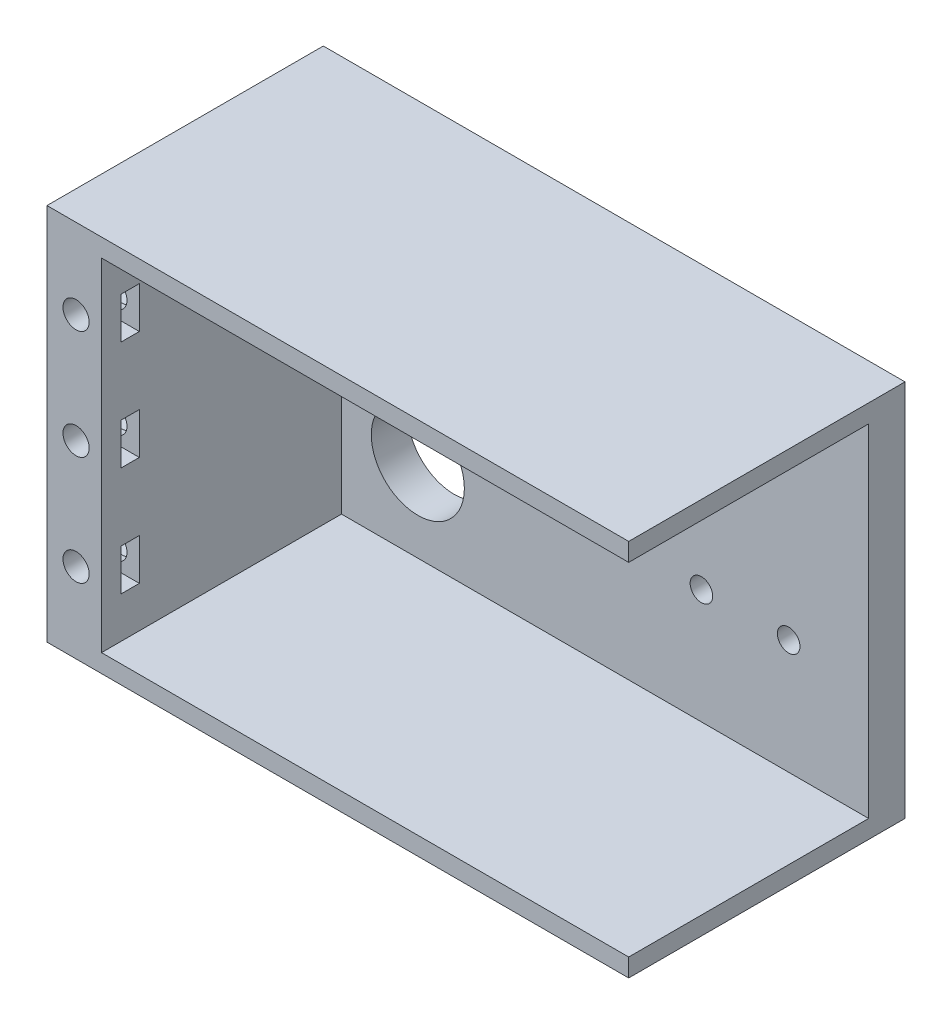
from build123d import *

# Parameters (mm, degrees)
ESQUISSE3_W                                        = 80
ESQUISSE3_H                                        = 52
BOSS_EXTRU_1_DEPTH                                 = 5
ESQUISSE4_R                                        = 6.4
ENL_V_MAT_EXTRU_1_DEPTH                            = 10
BOSS_EXTRU_2_DEPTH                                 = 33
CHAMBRAGE_POUR_VIS_T_TE_RONDE_BOMB_E_M_D           = 3.1
CHAMBRAGE_POUR_VIS_T_TE_RONDE_BOMB_E_M_CBORE_D     = 6
CHAMBRAGE_POUR_VIS_T_TE_RONDE_BOMB_E_M_CBORE_DEPTH = 2.1
R_P_TITION_LIN_AIRE1_COUNT                         = 2
R_P_TITION_LIN_AIRE1_PITCH                         = 12
R_P_TITION_LIN_AIRE1_COUNT_DIR2                    = 2
R_P_TITION_LIN_AIRE1_PITCH_DIR2                    = 24
ENL_V_MAT_EXTRU_2_REACH                            = 94.304
ESQUISSE11_W                                       = 2.5
ESQUISSE11_H                                       = 5.7
R_P_TITION_LIN_AIRE2_COUNT                         = 3
R_P_TITION_LIN_AIRE2_PITCH                         = 15
R_P_TITION_LIN_AIRE3_COUNT                         = 3
R_P_TITION_LIN_AIRE3_PITCH                         = 15


with BuildPart() as part:
    # Esquisse3 → Boss.-Extru.1 (new body)
    with BuildSketch(Plane.XY):
        Rectangle(ESQUISSE3_W, ESQUISSE3_H)
    extrude(amount=BOSS_EXTRU_1_DEPTH)

    # Esquisse4 → Enlèv. mat.-Extru.1 (cut)
    with BuildSketch(Plane.XY.offset(5)):
        with Locations((-22, -12)):
            Circle(ESQUISSE4_R)
    extrude(amount=-ENL_V_MAT_EXTRU_1_DEPTH, mode=Mode.SUBTRACT)

    # Esquisse5 → Boss.-Extru.2 (add)
    with BuildSketch(Plane.XY.offset(5)):
        Polygon((-40, -26), (40, -26), (40, -23.5), (-32.5, -23.5), (-32.5, 23.5), (40, 23.5), (40, 26), (-40, 26), align=None)
    extrude(amount=BOSS_EXTRU_2_DEPTH)

    # Chambrage pour vis à tête ronde bombée M2.51 (through all)
    with Locations(Plane(origin=(0, 0, 0), x_dir=(-1, 0, 0), z_dir=(0, 0, -1))):
        with Locations((-17, 16.25)):
            chambrage_pour_vis_t_te_ronde_bomb_e_m = CounterBoreHole(CHAMBRAGE_POUR_VIS_T_TE_RONDE_BOMB_E_M_D / 2, CHAMBRAGE_POUR_VIS_T_TE_RONDE_BOMB_E_M_CBORE_D / 2, CHAMBRAGE_POUR_VIS_T_TE_RONDE_BOMB_E_M_CBORE_DEPTH)

    # Répétition linéaire1: Chambrage pour vis _ t_te ronde bomb_e M 2 × 2
    with Locations(*[(i * R_P_TITION_LIN_AIRE1_PITCH, -j * R_P_TITION_LIN_AIRE1_PITCH_DIR2, 0) for i in range(R_P_TITION_LIN_AIRE1_COUNT) for j in range(R_P_TITION_LIN_AIRE1_COUNT_DIR2) if (i, j) != (0, 0)]):
        add(chambrage_pour_vis_t_te_ronde_bomb_e_m, mode=Mode.SUBTRACT)

    # Esquisse11 → Enlèv. mat.-Extru.2 (cut, up to next)
    with BuildSketch(Plane.ZY.offset(40), mode=Mode.PRIVATE) as enl_v_mat_extru_2_sk1:
        with Locations((34.05, 15)):
            Rectangle(ESQUISSE11_W, ESQUISSE11_H)
    enl_v_mat_extru_2_tool1 = extrude(enl_v_mat_extru_2_sk1.sketch, amount=-ENL_V_MAT_EXTRU_2_REACH, mode=Mode.PRIVATE) & part.part
    enl_v_mat_extru_2 = enl_v_mat_extru_2_tool1.solids().sort_by_distance((-40, 15, 34.05))[0]
    add(enl_v_mat_extru_2, mode=Mode.SUBTRACT)

    # Répétition linéaire2: Enlèv. mat.-Extru.2 ×3
    with Locations(*[(0, -i * R_P_TITION_LIN_AIRE2_PITCH, 0) for i in range(1, R_P_TITION_LIN_AIRE2_COUNT)]):
        add(enl_v_mat_extru_2, mode=Mode.SUBTRACT)

    # Esquisse15 → Dégagement M31 (revolve, cut)
    with BuildSketch(Plane(origin=(-36, 15, 38), x_dir=(0, -1, 0), z_dir=(1, 0, 0))):
        Polygon((0, 0), (0, 7.431549114), (1.8, 6.35), (1.8, 0), align=None)
    d_gagement_m31 = revolve(axis=Axis((-36, 15, 44.35), (0, 0, -1)), mode=Mode.SUBTRACT)

    # Répétition linéaire3: Dégagement M31 ×3
    with Locations(*[(0, -i * R_P_TITION_LIN_AIRE3_PITCH, 0) for i in range(1, R_P_TITION_LIN_AIRE3_COUNT)]):
        add(d_gagement_m31, mode=Mode.SUBTRACT)


solid = part.part
